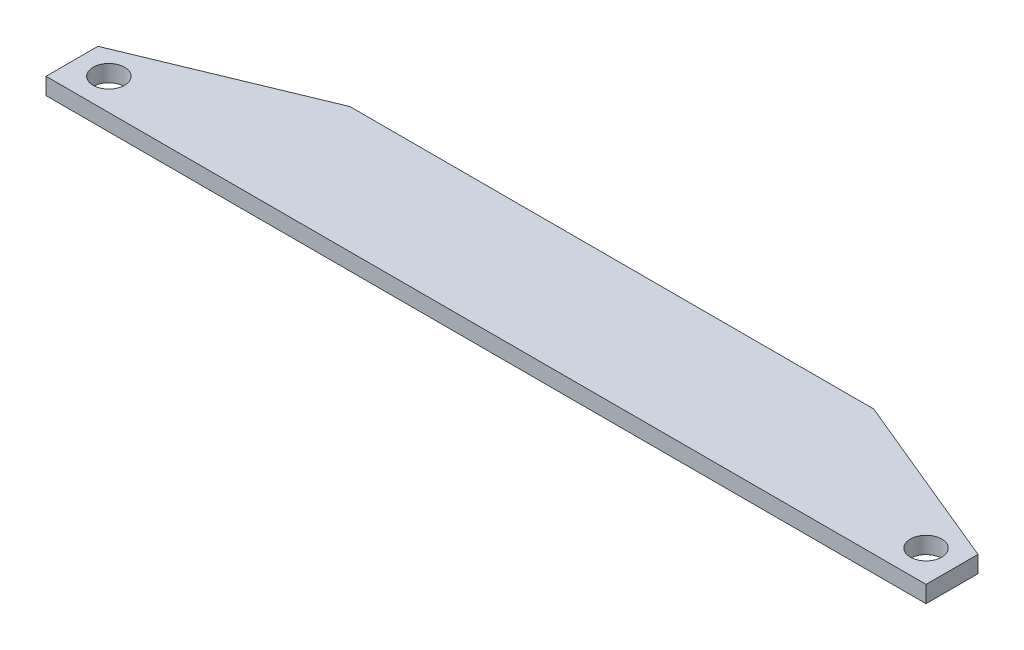
from build123d import *

# Parameters (mm, degrees)
BOSS_EXTRUDE1_DEPTH = 1.6
SKETCH4_R           = 1.5
CUT_EXTRUDE2_DEPTH  = 1.6


with BuildPart() as part:
    # Sketch1 → Boss-Extrude1 (new body)
    with BuildSketch(Plane(origin=(0, 0, 0), x_dir=(1, 0, 0), z_dir=(0, 1, 0))):
        Polygon((-42, 0), (42, 0), (42, 4.95836944), (25, 12), (-25, 12), (-42, 4.95836944), align=None)
    extrude(amount=BOSS_EXTRUDE1_DEPTH)

    # Sketch4 → Cut-Extrude2 (cut)
    with BuildSketch(Plane(origin=(0, 1.6, 0), x_dir=(1, 0, 0), z_dir=(0, 1, 0))):
        with Locations(Location((-39, 3, 0), (0, 0, 270))):
            Circle(SKETCH4_R)
        with Locations(Location((39, 3, 0), (0, 0, 270))):
            Circle(SKETCH4_R)
    extrude(amount=-CUT_EXTRUDE2_DEPTH, mode=Mode.SUBTRACT)


solid = part.part
